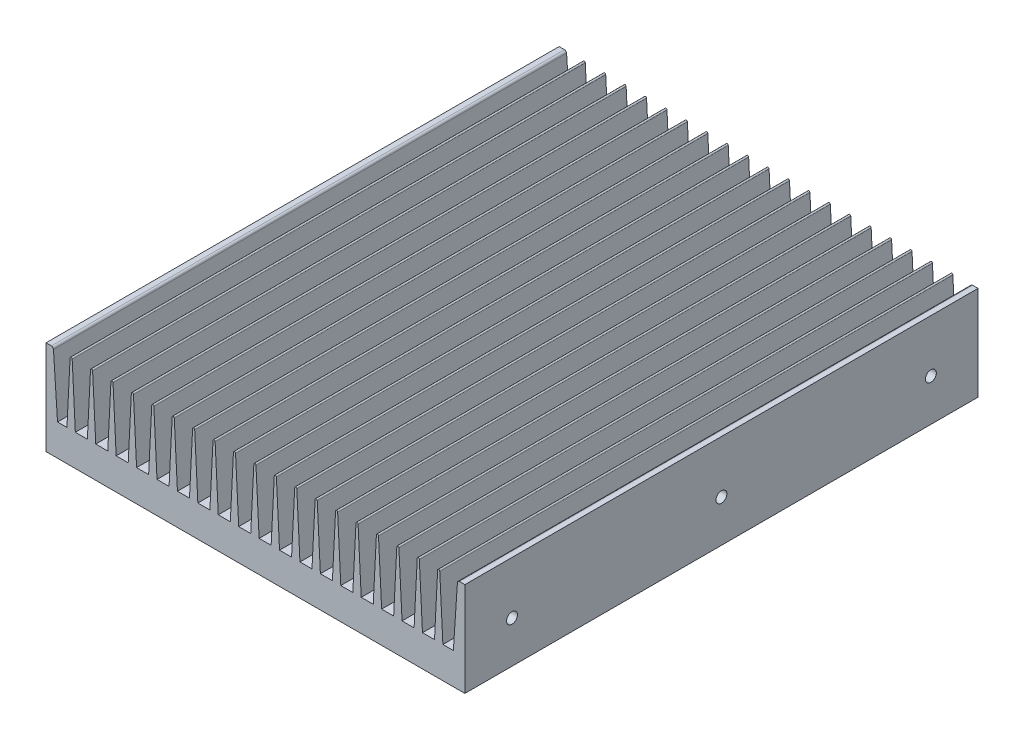
from build123d import *

# Parameters (mm, degrees)
EXTRUDE_1_DEPTH       = 245
EXTRUDE_3_DEPTH       = 245
PATTERN_CURVE_1_COUNT = 19
PATTERN_CURVE_1_PITCH = 9.75
SKETCH_7_R            = 2.6
CUT_EXTRUDE_4_DEPTH   = 6
CUT_EXTRUDE_START     = -8
SKETCH_13_R           = 2.6
CUT_EXTRUDE_9_DEPTH   = 8
SKETCH_15_R           = 2.1
SKETCH_15_R_2         = 1.6
CUT_EXTRUDE_10_DEPTH  = 10


with BuildPart() as part:
    # Эскиз1 → Вытянуть1 (new body)
    with BuildSketch(Plane.XY):
        with BuildLine():
            Line((0, 45), (2.564446908, 45))
            ThreePointArc((2.564446908, 45), (3.247630994, 44.730246195), (3.562232066, 44.066519011))
            Line((3.562232066, 44.066519011), (5.5, 15))
            Line((5.5, 15), (194.5, 15))
            Line((194.5, 15), (196.437767934, 44.066519011))
            ThreePointArc((196.437767934, 44.066519011), (196.752369006, 44.730246195), (197.435553092, 45))
            Line((197.435553092, 45), (200, 45))
            Line((200, 45), (200, 0))
            Line((200, 0), (0, 0))
            Line((0, 0), (0, 45))
        make_face()
    extrude(amount=EXTRUDE_1_DEPTH)

    # Эскиз2 → Вытянуть3 (add)
    with BuildSketch(Plane.XY.offset(245)):
        with BuildLine():
            Line((11.5, 44.5), (10, 15))
            Line((10, 15), (14, 15))
            Line((14, 15), (12.5, 44.5))
            ThreePointArc((12.5, 44.5), (12, 45), (11.5, 44.5))
        make_face()
    extrude_3 = extrude(amount=-EXTRUDE_3_DEPTH)

    # Кривая1: Вытянуть3 ×19
    with Locations(*[(i * PATTERN_CURVE_1_PITCH, 0, 0) for i in range(1, PATTERN_CURVE_1_COUNT)]):
        add(extrude_3)

    # Эскиз7 → Вырез-Вытянуть4 (cut)
    with BuildSketch(Plane.ZY):
        with Locations(Location((22.5, 20, 0), (0, 0, 270))):
            Circle(SKETCH_7_R)
        with Locations(Location((222.5, 20, 0), (0, 0, 270))):
            Circle(SKETCH_7_R)
        with Locations(Location((122.5, 20, 0), (0, 0, 270))):
            Circle(SKETCH_7_R)
    extrude(amount=-CUT_EXTRUDE_4_DEPTH, mode=Mode.SUBTRACT)

    # Эскиз13 → Вырез-Вытянуть9 (cut)
    with BuildSketch(Plane(origin=(200, 0, 0), x_dir=(0, 0, -1), z_dir=(1, 0, 0)).offset(CUT_EXTRUDE_START)):
        with Locations(Location((-222.5, 20, 0), (0, 0, 270))):
            Circle(SKETCH_13_R)
        with Locations(Location((-122.5, 20, 0), (0, 0, 270))):
            Circle(SKETCH_13_R)
        with Locations(Location((-22.5, 20, 0), (0, 0, 270))):
            Circle(SKETCH_13_R)
    extrude(amount=CUT_EXTRUDE_9_DEPTH, mode=Mode.SUBTRACT)

    # Эскиз15 → Вырез-Вытянуть10 (cut)
    with BuildSketch(Plane.XZ):
        with Locations((45, 42)):
            Circle(SKETCH_15_R)
        with Locations((116.5, 142.4)):
            Circle(SKETCH_15_R_2)
        with Locations((83, 142.4)):
            Circle(SKETCH_15_R_2)
        with Locations((40, 230)):
            Circle(SKETCH_15_R_2)
        with Locations((160, 230)):
            Circle(SKETCH_15_R_2)
        with Locations((40, 95)):
            Circle(SKETCH_15_R_2)
        with Locations((160, 95)):
            Circle(SKETCH_15_R_2)
    extrude(amount=-CUT_EXTRUDE_10_DEPTH, mode=Mode.SUBTRACT)


solid = part.part
